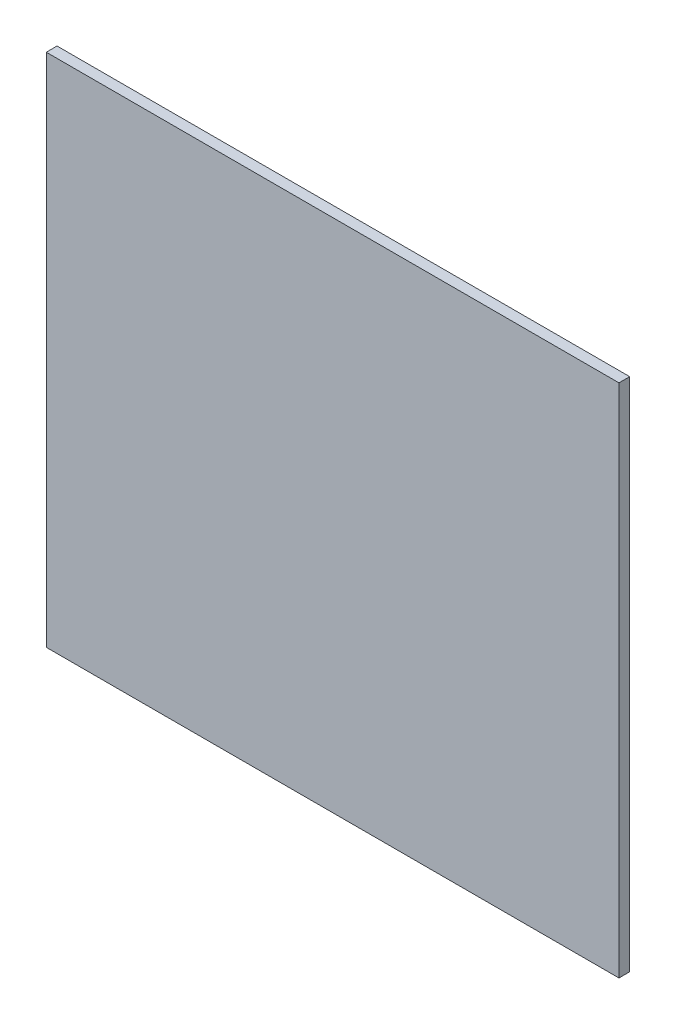
from build123d import *

# Parameters (mm, degrees)
SKETCH1_W           = 1016
SKETCH1_H           = 914.4
BOSS_EXTRUDE1_DEPTH = 19.05


with BuildPart() as part:
    # Sketch1 → Boss-Extrude1 (new body)
    with BuildSketch(Plane(origin=(0, 0, -914.4), x_dir=(-1, 0, 0), z_dir=(0, 0, -1))):
        with Locations((-508, 457.2)):
            Rectangle(SKETCH1_W, SKETCH1_H)
    extrude(amount=BOSS_EXTRUDE1_DEPTH)


solid = part.part
